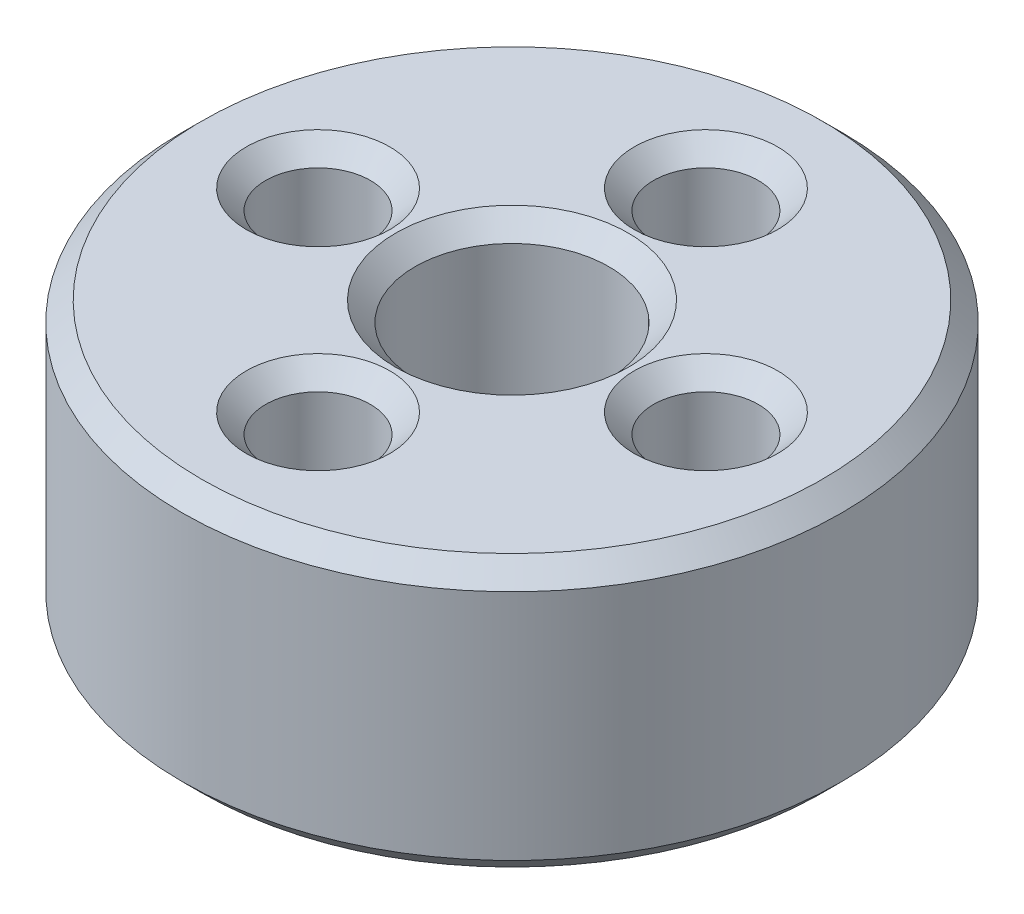
from build123d import *

# Parameters (mm, degrees)
SKETCH_1_R      = 8.5
SKETCH_1_R_2    = 1.35
SKETCH_1_R_3    = 2.5
EXTRUDE_1_DEPTH = 7
CHAMFER_1_SIZE  = 0.5


with BuildPart() as part:
    # 草图1 → 凸台-拉伸1 (new body)
    with BuildSketch(Plane(origin=(0, 0, 0), x_dir=(1, 0, 0), z_dir=(0, 1, 0))):
        with Locations(Location((0, 0, 0), (0, 0, 270))):
            Circle(SKETCH_1_R)
        with Locations(Location((-5, 0, 0), (0, 0, 270))):
            Circle(SKETCH_1_R_2, mode=Mode.SUBTRACT)
        with Locations(Location((0, 5, 0), (0, 0, 270))):
            Circle(SKETCH_1_R_2, mode=Mode.SUBTRACT)
        with Locations(Location((5, 0, 0), (0, 0, 270))):
            Circle(SKETCH_1_R_2, mode=Mode.SUBTRACT)
        with Locations(Location((0, -5, 0), (0, 0, 270))):
            Circle(SKETCH_1_R_2, mode=Mode.SUBTRACT)
        with Locations(Location((0, 0, 0), (0, 0, 270))):
            Circle(SKETCH_1_R_3, mode=Mode.SUBTRACT)
    extrude(amount=EXTRUDE_1_DEPTH)

    # 倒角1
    chamfer_1_edges = [part.edges().sort_by_distance(p)[0] for p in [
        (0, 0, -6.35),
        (0, 7, -6.35),
        (5, 0, -1.35),
        (5, 7, -1.35),
        (0, 0, -8.5),
        (0, 0, 3.65),
        (0, 7, 3.65),
        (0, 7, -8.5),
        (-5, 0, -1.35),
        (-5, 7, -1.35),
        (0, 0, -2.5),
        (0, 7, -2.5),
    ]]
    chamfer(chamfer_1_edges, length=CHAMFER_1_SIZE)


solid = part.part
